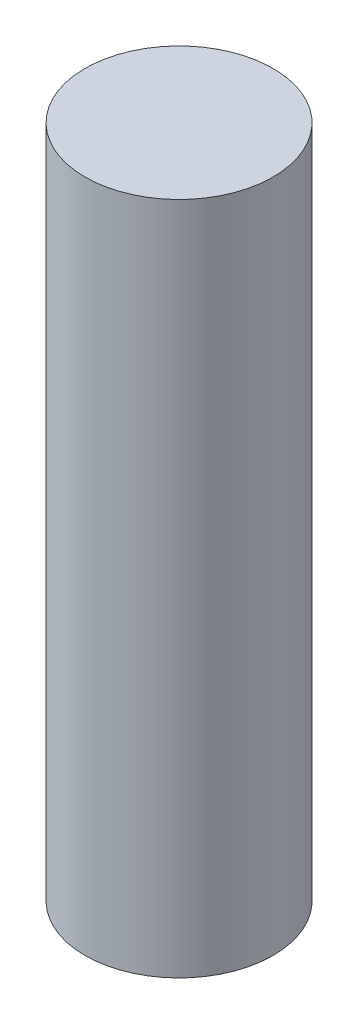
from build123d import *

# Parameters (mm, degrees)
SKETCH1_R           = 7.1755
BOSS_EXTRUDE1_DEPTH = 51.435


with BuildPart() as part:
    # Sketch1 → Boss-Extrude1 (new body)
    with BuildSketch(Plane(origin=(0, 0, 0), x_dir=(1, 0, 0), z_dir=(0, 1, 0))):
        with Locations(Location((0, 0, 0), (0, 0, 270))):
            Circle(SKETCH1_R)
    extrude(amount=BOSS_EXTRUDE1_DEPTH)


solid = part.part
